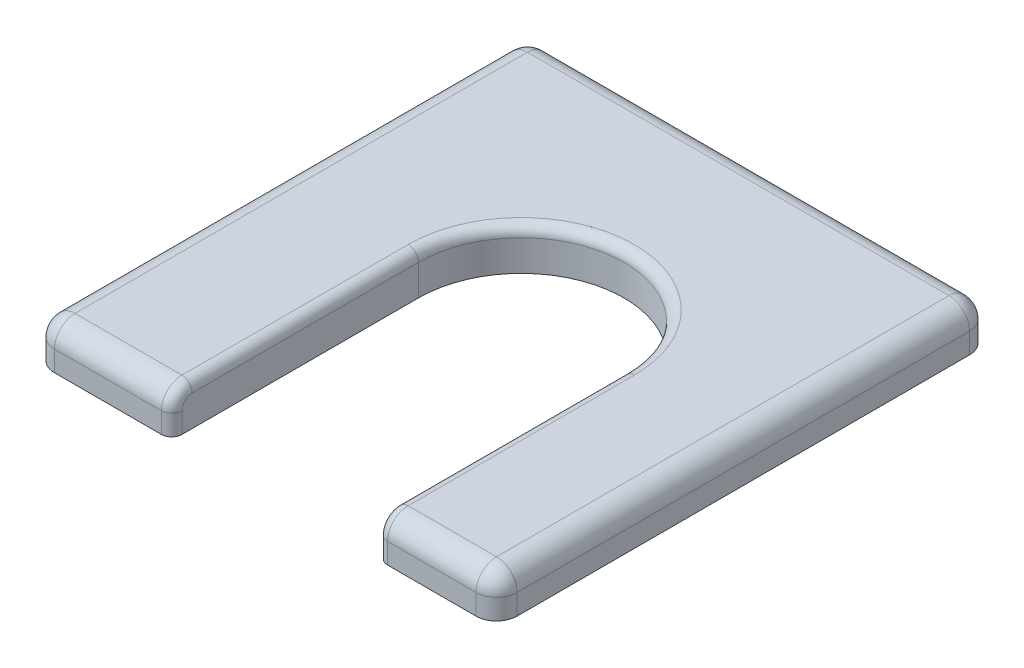
from build123d import *

# Parameters (mm, degrees)
SKETCH1_W           = 57.15
SKETCH1_H           = 60.96
BOSS_EXTRUDE1_DEPTH = 5.08
FILLET1_R           = 2.54
CUT_EXTRUDE1_REACH  = 85.714
FILLET2_R           = 1.27


with BuildPart() as part:
    # Sketch1 → Boss-Extrude1 (new body)
    with BuildSketch(Plane(origin=(0, 0, 0), x_dir=(1, 0, 0), z_dir=(0, 1, 0))):
        with Locations((28.575, 30.48)):
            Rectangle(SKETCH1_W, SKETCH1_H)
    extrude(amount=BOSS_EXTRUDE1_DEPTH)

    # Fillet1
    fillet1_edges = [part.edges().sort_by_distance(p)[0] for p in [
        (57.15, 5.08, -30.48),
        (28.575, 5.08, -60.96),
        (0, 5.08, -30.48),
        (0, 2.54, -60.96),
        (57.15, 2.54, -60.96),
        (57.15, 2.54, 0),
        (0, 2.54, 0),
        (28.575, 5.08, 0),
    ]]
    fillet(fillet1_edges, radius=FILLET1_R)

    # Cut-Extrude1: up to this face of the body (flat: up to its plane)
    cut_extrude1_end = Plane(part.part.faces().sort_by_distance((28.575, 0, -30.48))[0])
    # Sketch2 → Cut-Extrude1 (cut, up to the picked face)
    with BuildSketch(Plane(origin=(0, 5.08, 0), x_dir=(1, 0, 0), z_dir=(0, 1, 0)), mode=Mode.PRIVATE) as cut_extrude1_sk1:
        with BuildLine():
            Line((17.018, 30.48), (17.018, 0))
            Line((17.018, 0), (42.418, 0))
            Line((42.418, 0), (42.418, 30.48))
            ThreePointArc((42.418, 30.48), (29.718, 43.18), (17.018, 30.48))
        make_face()
    cut_extrude1_tool1 = split(extrude(cut_extrude1_sk1.sketch, amount=-CUT_EXTRUDE1_REACH, mode=Mode.PRIVATE), bisect_by=cut_extrude1_end, keep=Keep.BOTH, mode=Mode.PRIVATE)
    add(cut_extrude1_tool1.solids().sort_by(Axis((29.718, 5.08, -20.326586), (0, -1, 0)))[0], mode=Mode.SUBTRACT)

    # Fillet2
    fillet2_edges = [part.edges().sort_by_distance(p)[0] for p in [
        (42.418, 4.336051224, -0.743948776),
        (17.018, 4.336051224, -0.743948776),
        (42.418, 1.27, 0),
        (42.418, 5.08, -16.51),
        (29.718, 5.08, -43.18),
        (17.018, 5.08, -16.51),
        (17.018, 1.27, 0),
    ]]
    fillet(fillet2_edges, radius=FILLET2_R)


solid = part.part
